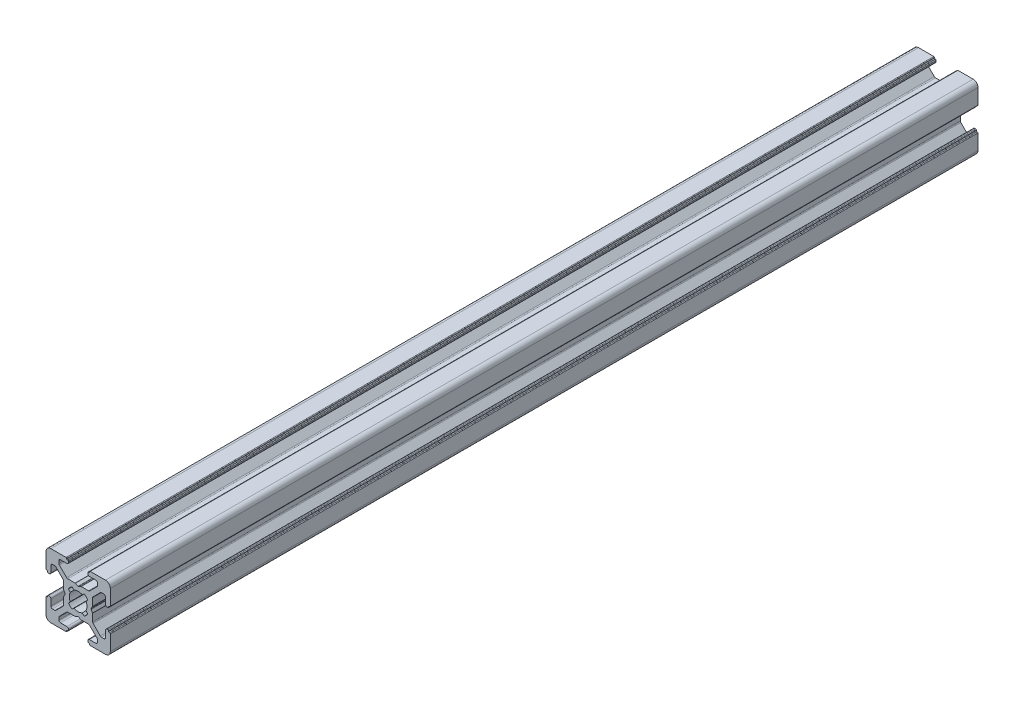
from build123d import *

# Parameters (mm, degrees)
EXTRUDE1_DEPTH = 270


with BuildPart() as part:
    # Sketch1 → Extrude1 (new body)
    with BuildSketch(Plane.XY):
        with BuildLine():
            Line((-3.5, 8.499999673), (-5.500000686, 8.499999673))
            ThreePointArc((-5.500000686, 8.499999673), (-5.853554077, 8.353553064), (-6.000000686, 7.999999673))
            Line((-6.000000686, 7.999999673), (-6.000000686, 7.267766626))
            ThreePointArc((-6.000000686, 7.267766626), (-5.961940448, 7.076424899), (-5.853554059, 6.914213219))
            Line((-5.853554059, 6.914213219), (-3.585787212, 4.646446592))
            ThreePointArc((-3.585787212, 4.646446592), (-3.423575544, 4.538060229), (-3.232233839, 4.5))
            Line((-3.232233839, 4.5), (-0.953590312, 4.5))
            ThreePointArc((-0.953590312, 4.5), (-0.901826505, 4.493185166), (-0.853590316, 4.473205083))
            Line((-0.853590316, 4.473205083), (-0.100000045, 4.038119562))
            ThreePointArc((-0.100000045, 4.038119562), (0, 4.011324632), (0.100000045, 4.038119562))
            Line((0.100000045, 4.038119562), (0.853590316, 4.473205083))
            ThreePointArc((0.853590316, 4.473205083), (0.901826505, 4.493185166), (0.953590312, 4.5))
            Line((0.953590312, 4.5), (3.232233839, 4.5))
            ThreePointArc((3.232233839, 4.5), (3.423575544, 4.538060229), (3.585787212, 4.646446592))
            Line((3.585787212, 4.646446592), (5.853554059, 6.914213219))
            ThreePointArc((5.853554059, 6.914213219), (5.961940448, 7.076424899), (6.000000686, 7.267766626))
            Line((6.000000686, 7.267766626), (6.000000686, 7.999999673))
            ThreePointArc((6.000000686, 7.999999673), (5.853554077, 8.353553064), (5.500000686, 8.499999673))
            Line((5.500000686, 8.499999673), (3.5, 8.499999673))
            ThreePointArc((3.5, 8.499999673), (3.146446609, 8.646446283), (3, 8.999999673))
            Line((3, 8.999999673), (3, 9.3))
            ThreePointArc((3, 9.3), (3.058578644, 9.441421356), (3.2, 9.5))
            Line((3.2, 9.5), (3.350000228, 9.5))
            ThreePointArc((3.350000228, 9.5), (3.491421584, 9.558578644), (3.550000228, 9.7))
            Line((3.550000228, 9.7), (3.550000228, 9.8))
            ThreePointArc((3.550000228, 9.8), (3.608578871, 9.941421356), (3.750000228, 10))
            Line((3.750000228, 10), (8.5, 10))
            ThreePointArc((8.5, 10), (9.560660172, 9.560660172), (10, 8.5))
            Line((10, 8.5), (10, 3.749999605))
            ThreePointArc((10, 3.749999605), (9.941421356, 3.608578248), (9.8, 3.549999605))
            Line((9.8, 3.549999605), (9.699999732, 3.549999605))
            ThreePointArc((9.699999732, 3.549999605), (9.558578376, 3.491420961), (9.499999732, 3.349999605))
            Line((9.499999732, 3.349999605), (9.499999732, 3.2))
            ThreePointArc((9.499999732, 3.2), (9.441421088, 3.058578644), (9.299999732, 3))
            Line((9.299999732, 3), (8.999999732, 3))
            ThreePointArc((8.999999732, 3), (8.646446341, 3.146446609), (8.499999732, 3.5))
            Line((8.499999732, 3.5), (8.499999732, 5.499999605))
            ThreePointArc((8.499999732, 5.499999605), (8.353553123, 5.853552995), (7.999999732, 5.999999605))
            Line((7.999999732, 5.999999605), (7.267766685, 5.999999605))
            ThreePointArc((7.267766685, 5.999999605), (7.076424969, 5.961939371), (6.914213294, 5.853552995))
            Line((6.914213294, 5.853552995), (4.646446398, 3.585786099))
            ThreePointArc((4.646446398, 3.585786099), (4.538060023, 3.423574425), (4.499999789, 3.232232708))
            Line((4.499999789, 3.232232708), (4.499999789, 0.953589302))
            ThreePointArc((4.499999789, 0.953589302), (4.493184953, 0.90182549), (4.473204867, 0.853589297))
            Line((4.473204867, 0.853589297), (4.038119841, 0.099999969))
            ThreePointArc((4.038119841, 0.099999969), (4.011324929, 0), (4.038119841, -0.099999969))
            Line((4.038119841, -0.099999969), (4.473204867, -0.853589297))
            ThreePointArc((4.473204867, -0.853589297), (4.493184953, -0.90182549), (4.499999789, -0.953589302))
            Line((4.499999789, -0.953589302), (4.499999789, -3.232232708))
            ThreePointArc((4.499999789, -3.232232708), (4.538060023, -3.423574425), (4.646446398, -3.585786099))
            Line((4.646446398, -3.585786099), (6.914213294, -5.853552995))
            ThreePointArc((6.914213294, -5.853552995), (7.076424969, -5.961939371), (7.267766685, -5.999999605))
            Line((7.267766685, -5.999999605), (7.999999732, -5.999999605))
            ThreePointArc((7.999999732, -5.999999605), (8.353553123, -5.853552995), (8.499999732, -5.499999605))
            Line((8.499999732, -5.499999605), (8.499999732, -3.5))
            ThreePointArc((8.499999732, -3.5), (8.646446341, -3.146446609), (8.999999732, -3))
            Line((8.999999732, -3), (9.299999732, -3))
            ThreePointArc((9.299999732, -3), (9.441421088, -3.058578644), (9.499999732, -3.2))
            Line((9.499999732, -3.2), (9.499999732, -3.349999605))
            ThreePointArc((9.499999732, -3.349999605), (9.558578376, -3.491420961), (9.699999732, -3.549999605))
            Line((9.699999732, -3.549999605), (9.8, -3.549999605))
            ThreePointArc((9.8, -3.549999605), (9.941421356, -3.608578248), (10, -3.749999605))
            Line((10, -3.749999605), (10, -8.5))
            ThreePointArc((10, -8.5), (9.560660172, -9.560660172), (8.5, -10))
            Line((8.5, -10), (3.750000228, -10))
            ThreePointArc((3.750000228, -10), (3.608578871, -9.941421356), (3.550000228, -9.8))
            Line((3.550000228, -9.8), (3.550000228, -9.7))
            ThreePointArc((3.550000228, -9.7), (3.491421584, -9.558578644), (3.350000228, -9.5))
            Line((3.350000228, -9.5), (3.2, -9.5))
            ThreePointArc((3.2, -9.5), (3.058578644, -9.441421356), (3, -9.3))
            Line((3, -9.3), (3, -8.999999673))
            ThreePointArc((3, -8.999999673), (3.146446609, -8.646446283), (3.5, -8.499999673))
            Line((3.5, -8.499999673), (5.500000686, -8.499999673))
            ThreePointArc((5.500000686, -8.499999673), (5.853554077, -8.353553064), (6.000000686, -7.999999673))
            Line((6.000000686, -7.999999673), (6.000000686, -7.267766626))
            ThreePointArc((6.000000686, -7.267766626), (5.961940448, -7.076424899), (5.853554059, -6.914213219))
            Line((5.853554059, -6.914213219), (3.585787212, -4.646446592))
            ThreePointArc((3.585787212, -4.646446592), (3.423575544, -4.538060229), (3.232233839, -4.5))
            Line((3.232233839, -4.5), (0.953590312, -4.5))
            ThreePointArc((0.953590312, -4.5), (0.901826505, -4.493185166), (0.853590316, -4.473205083))
            Line((0.853590316, -4.473205083), (0.100000045, -4.038119562))
            ThreePointArc((0.100000045, -4.038119562), (0, -4.011324632), (-0.100000045, -4.038119562))
            Line((-0.100000045, -4.038119562), (-0.853590316, -4.473205083))
            ThreePointArc((-0.853590316, -4.473205083), (-0.901826505, -4.493185166), (-0.953590312, -4.5))
            Line((-0.953590312, -4.5), (-3.232233839, -4.5))
            ThreePointArc((-3.232233839, -4.5), (-3.423575544, -4.538060229), (-3.585787212, -4.646446592))
            Line((-3.585787212, -4.646446592), (-5.853554059, -6.914213219))
            ThreePointArc((-5.853554059, -6.914213219), (-5.961940448, -7.076424899), (-6.000000686, -7.267766626))
            Line((-6.000000686, -7.267766626), (-6.000000686, -7.999999673))
            ThreePointArc((-6.000000686, -7.999999673), (-5.853554077, -8.353553064), (-5.500000686, -8.499999673))
            Line((-5.500000686, -8.499999673), (-3.5, -8.499999673))
            ThreePointArc((-3.5, -8.499999673), (-3.146446609, -8.646446283), (-3, -8.999999673))
            Line((-3, -8.999999673), (-3, -9.3))
            ThreePointArc((-3, -9.3), (-3.058578644, -9.441421356), (-3.2, -9.5))
            Line((-3.2, -9.5), (-3.350000228, -9.5))
            ThreePointArc((-3.350000228, -9.5), (-3.491421584, -9.558578644), (-3.550000228, -9.7))
            Line((-3.550000228, -9.7), (-3.550000228, -9.8))
            ThreePointArc((-3.550000228, -9.8), (-3.608578871, -9.941421356), (-3.750000228, -10))
            Line((-3.750000228, -10), (-8.5, -10))
            ThreePointArc((-8.5, -10), (-9.560660172, -9.560660172), (-10, -8.5))
            Line((-10, -8.5), (-10, -3.749999605))
            ThreePointArc((-10, -3.749999605), (-9.941421356, -3.608578248), (-9.8, -3.549999605))
            Line((-9.8, -3.549999605), (-9.699999732, -3.549999605))
            ThreePointArc((-9.699999732, -3.549999605), (-9.558578376, -3.491420961), (-9.499999732, -3.349999605))
            Line((-9.499999732, -3.349999605), (-9.499999732, -3.2))
            ThreePointArc((-9.499999732, -3.2), (-9.441421088, -3.058578644), (-9.299999732, -3))
            Line((-9.299999732, -3), (-8.999999732, -3))
            ThreePointArc((-8.999999732, -3), (-8.646446341, -3.146446609), (-8.499999732, -3.5))
            Line((-8.499999732, -3.5), (-8.499999732, -5.499999605))
            ThreePointArc((-8.499999732, -5.499999605), (-8.353553123, -5.853552995), (-7.999999732, -5.999999605))
            Line((-7.999999732, -5.999999605), (-7.267766685, -5.999999605))
            ThreePointArc((-7.267766685, -5.999999605), (-7.076424969, -5.961939371), (-6.914213294, -5.853552995))
            Line((-6.914213294, -5.853552995), (-4.646446398, -3.585786099))
            ThreePointArc((-4.646446398, -3.585786099), (-4.538060023, -3.423574425), (-4.499999789, -3.232232708))
            Line((-4.499999789, -3.232232708), (-4.499999789, -0.953589302))
            ThreePointArc((-4.499999789, -0.953589302), (-4.493184953, -0.90182549), (-4.473204867, -0.853589297))
            Line((-4.473204867, -0.853589297), (-4.038119841, -0.099999969))
            ThreePointArc((-4.038119841, -0.099999969), (-4.011324929, 0), (-4.038119841, 0.099999969))
            Line((-4.038119841, 0.099999969), (-4.473204867, 0.853589297))
            ThreePointArc((-4.473204867, 0.853589297), (-4.493184953, 0.90182549), (-4.499999789, 0.953589302))
            Line((-4.499999789, 0.953589302), (-4.499999789, 3.232232708))
            ThreePointArc((-4.499999789, 3.232232708), (-4.538060023, 3.423574425), (-4.646446398, 3.585786099))
            Line((-4.646446398, 3.585786099), (-6.914213294, 5.853552995))
            ThreePointArc((-6.914213294, 5.853552995), (-7.076424969, 5.961939371), (-7.267766685, 5.999999605))
            Line((-7.267766685, 5.999999605), (-7.999999732, 5.999999605))
            ThreePointArc((-7.999999732, 5.999999605), (-8.353553123, 5.853552995), (-8.499999732, 5.499999605))
            Line((-8.499999732, 5.499999605), (-8.499999732, 3.5))
            ThreePointArc((-8.499999732, 3.5), (-8.646446341, 3.146446609), (-8.999999732, 3))
            Line((-8.999999732, 3), (-9.299999732, 3))
            ThreePointArc((-9.299999732, 3), (-9.441421088, 3.058578644), (-9.499999732, 3.2))
            Line((-9.499999732, 3.2), (-9.499999732, 3.349999605))
            ThreePointArc((-9.499999732, 3.349999605), (-9.558578376, 3.491420961), (-9.699999732, 3.549999605))
            Line((-9.699999732, 3.549999605), (-9.8, 3.549999605))
            ThreePointArc((-9.8, 3.549999605), (-9.941421356, 3.608578248), (-10, 3.749999605))
            Line((-10, 3.749999605), (-10, 8.5))
            ThreePointArc((-10, 8.5), (-9.560660172, 9.560660172), (-8.5, 10))
            Line((-8.5, 10), (-3.750000228, 10))
            ThreePointArc((-3.750000228, 10), (-3.608578871, 9.941421356), (-3.550000228, 9.8))
            Line((-3.550000228, 9.8), (-3.550000228, 9.7))
            ThreePointArc((-3.550000228, 9.7), (-3.491421584, 9.558578644), (-3.350000228, 9.5))
            Line((-3.350000228, 9.5), (-3.2, 9.5))
            ThreePointArc((-3.2, 9.5), (-3.058578644, 9.441421356), (-3, 9.3))
            Line((-3, 9.3), (-3, 8.999999673))
            ThreePointArc((-3, 8.999999673), (-3.146446609, 8.646446283), (-3.5, 8.499999673))
        make_face()
        with BuildLine():
            Line((-1.258185436, 2.445295362), (-1.91389502, 2.989640962))
            ThreePointArc((-1.91389502, 2.989640962), (-2.511737261, 2.508410485), (-2.992174953, 1.909930962))
            Line((-2.992174953, 1.909930962), (-2.445295423, 1.258185317))
            ThreePointArc((-2.445295423, 1.258185317), (-2.75, 0), (-2.445295423, -1.258185317))
            Line((-2.445295423, -1.258185317), (-2.992174953, -1.909930962))
            ThreePointArc((-2.992174953, -1.909930962), (-2.511737261, -2.508410485), (-1.91389502, -2.989640962))
            Line((-1.91389502, -2.989640962), (-1.258185436, -2.445295362))
            ThreePointArc((-1.258185436, -2.445295362), (0, -2.75), (1.258185436, -2.445295362))
            Line((1.258185436, -2.445295362), (1.91389502, -2.989640962))
            ThreePointArc((1.91389502, -2.989640962), (2.511737261, -2.508410485), (2.992174953, -1.909930962))
            Line((2.992174953, -1.909930962), (2.445295423, -1.258185317))
            ThreePointArc((2.445295423, -1.258185317), (2.75, 0), (2.445295423, 1.258185317))
            Line((2.445295423, 1.258185317), (2.992174953, 1.909930962))
            ThreePointArc((2.992174953, 1.909930962), (2.511737261, 2.508410485), (1.91389502, 2.989640962))
            Line((1.91389502, 2.989640962), (1.258185436, 2.445295362))
            ThreePointArc((1.258185436, 2.445295362), (0, 2.75), (-1.258185436, 2.445295362))
        make_face(mode=Mode.SUBTRACT)
    extrude(amount=EXTRUDE1_DEPTH)


solid = part.part
